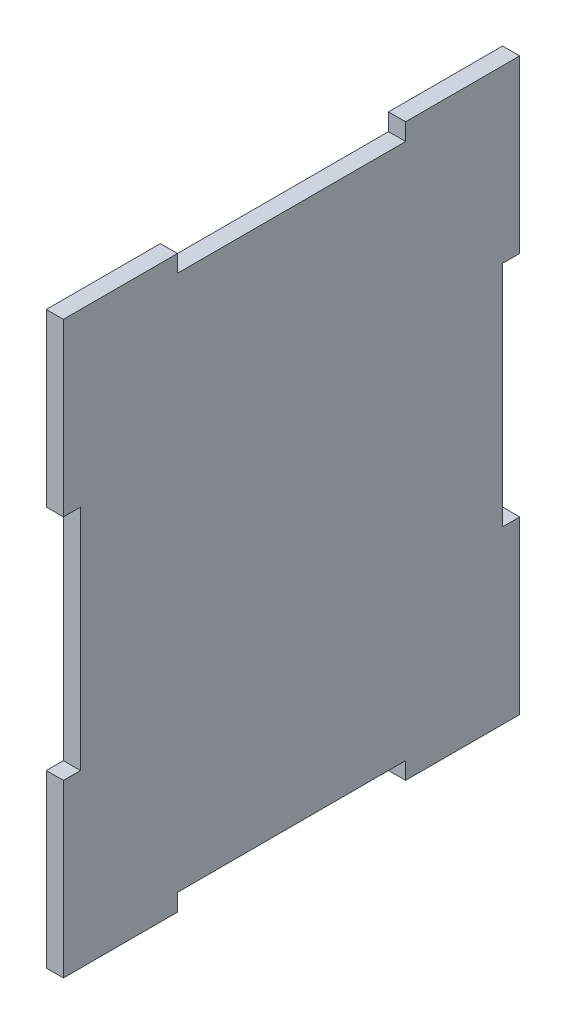
from build123d import *

# Parameters (mm, degrees)
BOSS_EXTRU_2_DEPTH = 3


with BuildPart() as part:
    # Esquisse1 → Boss.-Extru.2 (new body)
    with BuildSketch(Plane(origin=(0, 0, 0), x_dir=(0, 0, -1), z_dir=(1, 0, 0))):
        Polygon((34.264523911, 38.07488006), (54.264523911, 38.07488006), (54.264523911, 8.07488006), (51.264523911, 8.07488006), (51.264523911, -31.92511994), (54.264523911, -31.92511994), (54.264523911, -61.92511994), (34.264523911, -61.92511994), (34.264523911, -58.92511994), (-5.735476089, -58.92511994), (-5.735476089, -61.92511994), (-25.735476089, -61.92511994), (-25.735476089, -31.92511994), (-22.735476089, -31.92511994), (-22.735476089, 8.07488006), (-25.735476089, 8.07488006), (-25.735476089, 38.07488006), (-5.735476089, 38.07488006), (-5.735476089, 35.07488006), (34.264523911, 35.07488006), align=None)
    extrude(amount=BOSS_EXTRU_2_DEPTH)


solid = part.part
